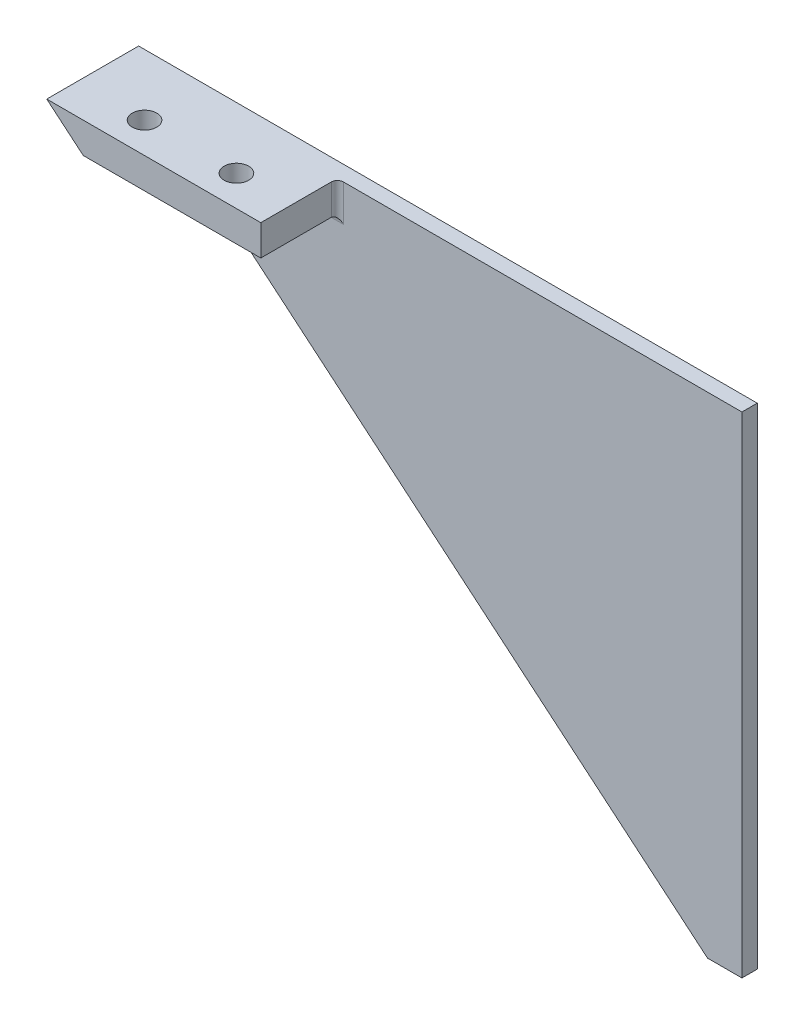
from build123d import *

# Parameters (mm, degrees)
SKETCH_1_W          = 280
SKETCH_1_H          = 150
EXTRUDE_1_DEPTH     = 5
SKETCH_2_W          = 280
SKETCH_2_H          = 25
EXTRUDE_3_DEPTH     = 10
CUT_EXTRUDE_1_DEPTH = 500
SKETCH_7_R          = 4
CUT_EXTRUDE_2_DEPTH = 1000
SKETCH_8_W          = 112.049433073
SKETCH_8_H          = 25
CUT_EXTRUDE_3_DEPTH = 1000
SKETCH_9_W          = 5
SKETCH_9_H          = 160
EXTRUDE_4_DEPTH     = 20
EXTRUDE_5_DEPTH     = 5
CUT_EXTRUDE_4_DEPTH = 50
FILLET_1_R          = 2
FILLET_2_R          = 2


with BuildPart() as part:
    # 草图1 → 凸台-拉伸1 (new body)
    with BuildSketch(Plane.XY):
        Rectangle(SKETCH_1_W, SKETCH_1_H)
    extrude(amount=EXTRUDE_1_DEPTH)

    # 草图2 → 凸台-拉伸3 (add)
    with BuildSketch(Plane(origin=(0, 75, 0), x_dir=(1, 0, 0), z_dir=(0, 1, 0))):
        with Locations((0, -17.5)):
            Rectangle(SKETCH_2_W, SKETCH_2_H)
    extrude(amount=-EXTRUDE_3_DEPTH)

    # 草图6 → 切除-拉伸1 (cut, symmetric)
    with BuildSketch(Plane.XY.offset(5)):
        Polygon((154.593930268, -89.892698805), (-30, 65), (-77.119612047, 104.53804909), (-170.923908706, 102.008061066), (-172.604783039, -51.581831085), (-172.604783039, -108.521449105), align=None)
    extrude(amount=CUT_EXTRUDE_1_DEPTH, both=True, mode=Mode.SUBTRACT)

    # 草图7 → 切除-拉伸2 (cut)
    with BuildSketch(Plane.XZ.offset(-65)):
        with Locations(Location((-20, 20, 0), (0, 0, 270))):
            Circle(SKETCH_7_R)
        with Locations(Location((10, 20, 0), (0, 0, 270))):
            Circle(SKETCH_7_R)
    extrude(amount=-CUT_EXTRUDE_2_DEPTH, mode=Mode.SUBTRACT)

    # 草图8 → 切除-拉伸3 (cut)
    with BuildSketch(Plane.XZ.offset(-65)):
        with Locations((83.975283464, 17.5)):
            Rectangle(SKETCH_8_W, SKETCH_8_H)
    extrude(amount=-CUT_EXTRUDE_3_DEPTH, mode=Mode.SUBTRACT)

    # 草图9 → 凸台-拉伸4 (add)
    with BuildSketch(Plane(origin=(140, 0, 0), x_dir=(0, 0, -1), z_dir=(1, 0, 0))):
        with Locations((-2.5, -5)):
            Rectangle(SKETCH_9_W, SKETCH_9_H)
    extrude(amount=EXTRUDE_4_DEPTH)

    # 草图10 → 凸台-拉伸5 (add)
    with BuildSketch(Plane.XY.offset(5)):
        Polygon((136.845502963, -75), (140, -77.6469373), (140, -75), align=None)
    extrude(amount=-EXTRUDE_5_DEPTH)

    # 草图11 → 切除-拉伸4 (cut)
    with BuildSketch(Plane.XY.offset(5)):
        Polygon((140, -77.6469373), (159.760548741, -94.228006461), (119.027644691, -86.706463214), align=None)
    extrude(amount=-CUT_EXTRUDE_4_DEPTH, mode=Mode.SUBTRACT)

    # 圆角1
    fillet_1_edges = [part.edges().sort_by_distance(p)[0] for p in [
        (-1.024716536, 65, 5),
    ]]
    fillet(fillet_1_edges, radius=FILLET_1_R)

    # 圆角2
    fillet_2_edges = [part.edges().sort_by_distance(p)[0] for p in [
        (27.950566927, 69, 5),
    ]]
    fillet(fillet_2_edges, radius=FILLET_2_R)


solid = part.part
